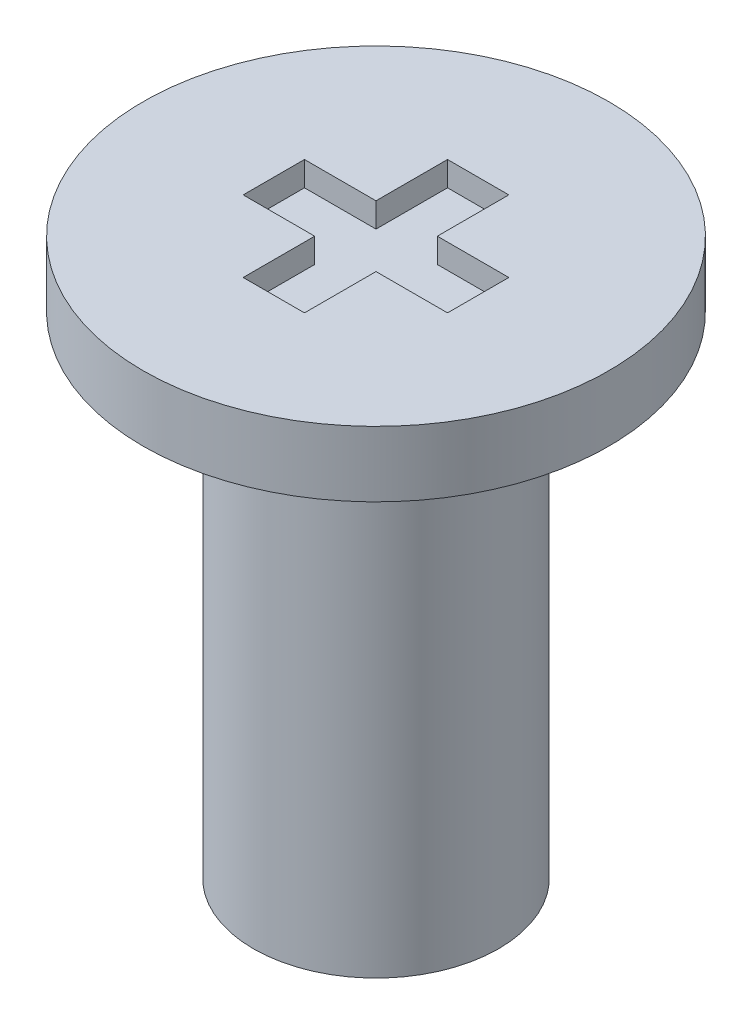
from build123d import *

# Parameters (mm, degrees)
SKETCH_2_W               = 0.75
SKETCH_2_H               = 1.25
CUT_EXTRUDE_1_DEPTH      = 0.3
PATTERN_CIRCULAR_1_COUNT = 4


with BuildPart() as part:
    # ｽｹｯﾁ1 → 回転1 (revolve)
    with BuildSketch(Plane.XY, mode=Mode.PRIVATE) as revolve_1_sk:
        Polygon((0, 0), (2.85, 0), (2.85, -0.8), (1.5, -0.8), (1.5, -6.8), (0, -6.8), align=None)
    revolve(revolve_1_sk.sketch.rotate(Axis((0, -6.8, 0), (0, 1, 0)), 90), axis=Axis((0, -6.8, 0), (0, 1, 0)))

    # ｽｹｯﾁ2 → ｶｯﾄ - 押し出し1 (cut)
    with BuildSketch(Plane(origin=(0, 0, 0), x_dir=(1, 0, 0), z_dir=(0, 1, 0))):
        with Locations((0, 0.625)):
            Rectangle(SKETCH_2_W, SKETCH_2_H)
    cut_extrude_1 = extrude(amount=-CUT_EXTRUDE_1_DEPTH, mode=Mode.SUBTRACT)

    # 円形ﾊﾟﾀｰﾝ1: ｶｯﾄ - 押し出し1 ×4 about axis
    pattern_circular_1_axis = Axis((0, 0, 0), (0, 1, 0))
    for i in range(1, PATTERN_CIRCULAR_1_COUNT):
        add(cut_extrude_1.rotate(pattern_circular_1_axis, i * 360 / PATTERN_CIRCULAR_1_COUNT), mode=Mode.SUBTRACT)


solid = part.part
